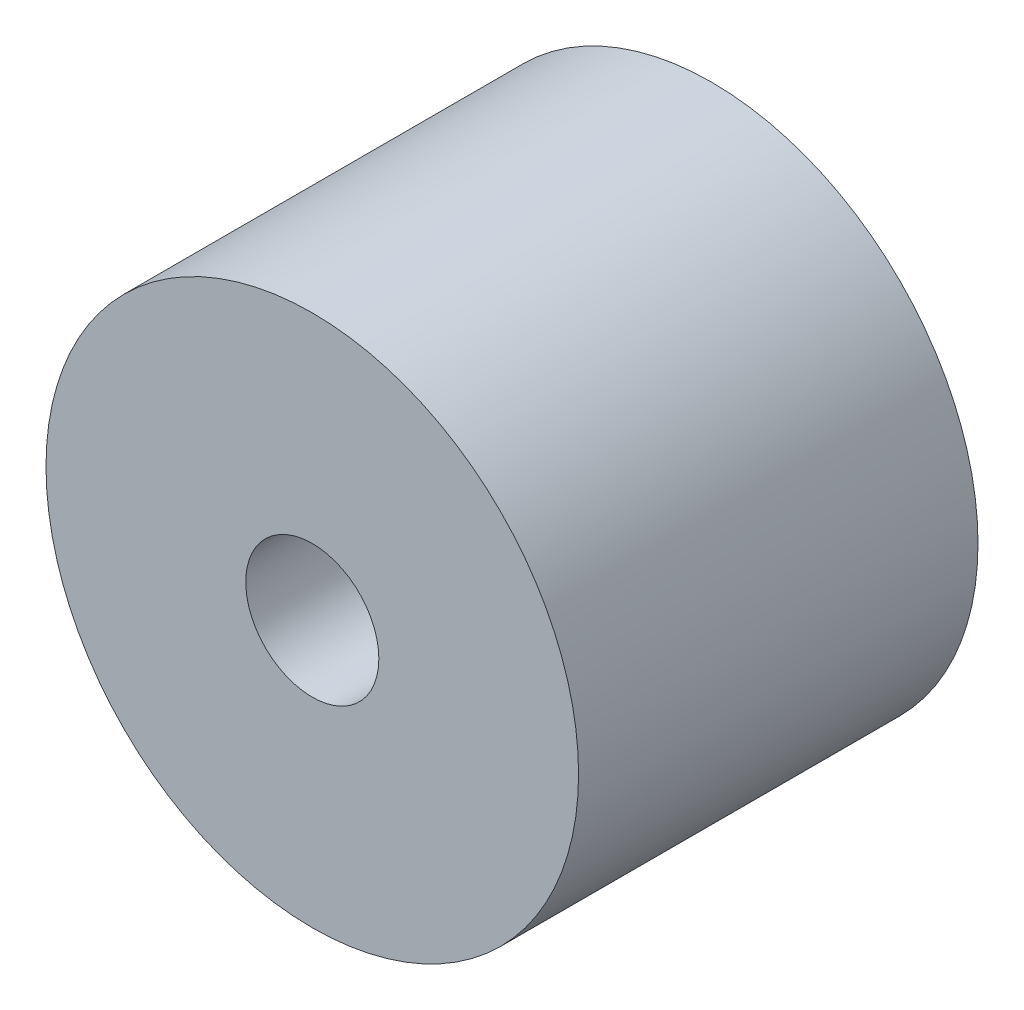
from build123d import *

# Parameters (mm, degrees)
SKETCH1_R           = 100
BOSS_EXTRUDE1_DEPTH = 150
SKETCH2_R           = 25
CUT_EXTRUDE1_DEPTH  = 50


with BuildPart() as part:
    # Sketch1 → Boss-Extrude1 (new body)
    with BuildSketch(Plane.XY):
        Circle(SKETCH1_R)
    extrude(amount=BOSS_EXTRUDE1_DEPTH)

    # Sketch2 → Cut-Extrude1 (cut)
    with BuildSketch(Plane.XY.offset(150)):
        Circle(SKETCH2_R)
    extrude(amount=-CUT_EXTRUDE1_DEPTH, mode=Mode.SUBTRACT)


solid = part.part
